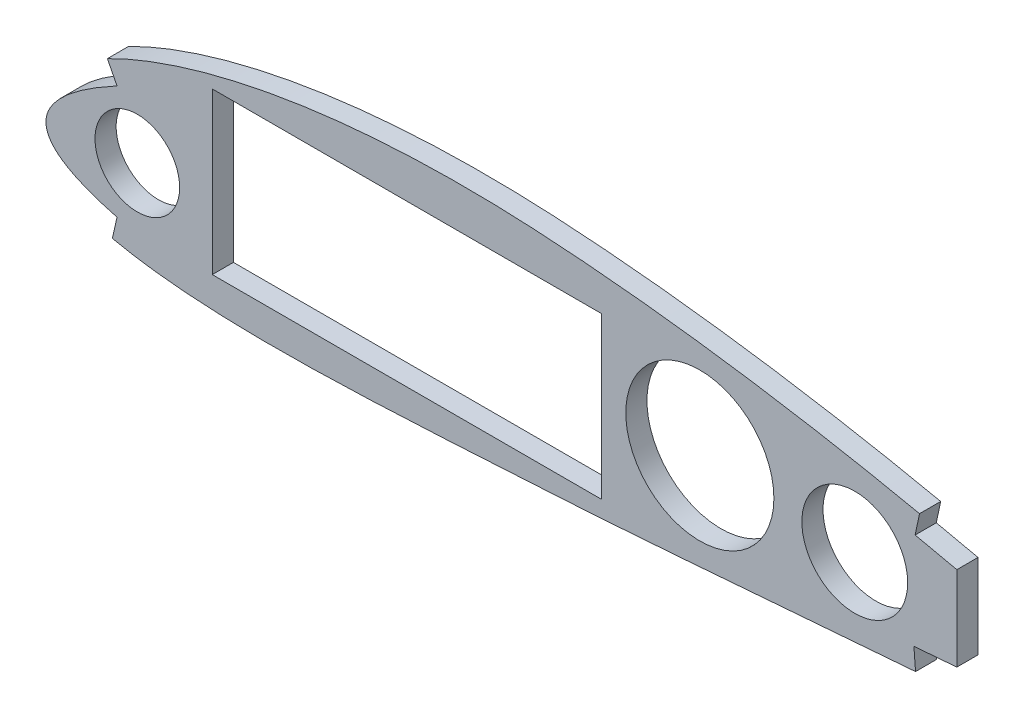
from build123d import *

# Parameters (mm, degrees)
MASTER_SKETCH_WING_GEOMETRY_MASTER_SKETC_R   = 10
MASTER_SKETCH_WING_GEOMETRY_MASTER_SKETC_W   = 92
MASTER_SKETCH_WING_GEOMETRY_MASTER_SKETC_H   = 38
MASTER_SKETCH_WING_GEOMETRY_MASTER_SKETC_R_2 = 12.5
MASTER_SKETCH_WING_GEOMETRY_MASTER_SKETC_R_3 = 17.5
BOSS_EXTRUDE2_DEPTH                          = 5


with BuildPart() as part:
    # Master sketch-Wing Geometry Master Sketc → Boss-Extrude2 (new body)
    with BuildSketch(Plane.XY):
        with BuildLine():
            Line((210.07475011, 20.55043194), (211.114806417, 25.441064095))
            add(Edge.make_bspline(
                [(211.114806417, 25.441064095), (210.423359837, 25.588109171), (208.256226378, 26.046518307), (204.590060504, 26.80992466), (200.100470305, 27.709491549), (195.551555784, 28.574874953), (190.957101153, 29.440580512), (186.312819207, 30.266153712), (181.629850434, 31.069092462), (176.911633472, 31.833504414), (172.163553808, 32.589756341), (167.386378314, 33.297913229), (162.585397476, 33.965141895), (157.772606773, 34.60690524), (152.945783838, 35.207030951), (148.116103717, 35.768371218), (143.281947921, 36.275964114), (138.451826021, 36.746166863), (133.632024585, 37.177420244), (128.825099136, 37.557009572), (124.035268277, 37.890964919), (119.227934324, 38.158056396), (114.414879536, 38.383930966), (109.600810746, 38.523171189), (104.830170116, 38.581209103), (100.103024464, 38.571187104), (95.428917776, 38.495242632), (90.811807971, 38.332326352), (86.257821528, 38.103740215), (81.770642032, 37.802892678), (77.355663903, 37.439401702), (73.023107372, 36.981755849), (68.77458737, 36.478522782), (64.618104025, 35.895217538), (60.552867783, 35.25916861), (56.589427231, 34.548268384), (52.728147609, 33.780528228), (48.978480985, 32.948622201), (45.340648206, 32.070500948), (41.817597831, 31.144685204), (38.422513869, 30.152277869), (35.148426276, 29.122139824), (32.002488884, 28.056760571), (28.991053216, 26.94735735), (26.116143259, 25.797761949), (23.382030001, 24.605992477), (21.092241599, 23.54817715), (19.726805869, 22.866225277), (19.219088354, 22.606550883)],
                knots=[0.147831525, 0.147831525, 0.147831525, 0.147831525, 0.151223285, 0.15845953, 0.165799086, 0.173192204, 0.180676633, 0.188231103, 0.195824579, 0.203473251, 0.211164227, 0.218892942, 0.226644195, 0.234420668, 0.24218898, 0.249981423, 0.257749175, 0.26551047, 0.273265831, 0.280966678, 0.288645672, 0.296302699, 0.304067471, 0.31176355, 0.319408994, 0.326957892, 0.334443893, 0.34183727, 0.349123554, 0.356320599, 0.363414403, 0.370376839, 0.377222796, 0.383940401, 0.390513899, 0.396964017, 0.403259098, 0.409401768, 0.415391075, 0.421213922, 0.426877502, 0.432360647, 0.437681281, 0.442812195, 0.447757077, 0.452534713, 0.457121248, 0.459857253, 0.459857253, 0.459857253, 0.459857253], degree=3))
            Line((19.219088354, 22.606550883), (21.49585547, 18.154997053))
            add(Edge.make_bspline(
                [(21.49585547, 18.154997053), (-12.082056869, 0.079644189), (21.495939944, -8.707202746)],
                knots=[0, 0, 0, 1, 1, 1], degree=2))
            Line((21.495939944, -8.707202746), (20.394317181, -13.584335848))
            add(Edge.make_bspline(
                [(20.394317181, -13.584335848), (20.878636368, -13.693731476), (22.176487001, -13.975597653), (24.333802223, -14.388616706), (26.902677481, -14.802759919), (29.579032983, -15.186644107), (32.364727066, -15.507317142), (35.24979682, -15.818395551), (38.24224316, -16.045446189), (41.331828524, -16.260981777), (44.519015875, -16.42830612), (47.799283263, -16.558119697), (51.16623897, -16.647932894), (54.61986093, -16.695073811), (58.159965351, -16.714295991), (61.783518843, -16.708264717), (65.483463359, -16.650825987), (69.256985649, -16.584892049), (73.10377458, -16.484484885), (77.020259272, -16.35080262), (81.003979497, -16.205643438), (85.050068364, -16.018089633), (89.157165379, -15.833715938), (93.320145134, -15.619391907), (97.536821023, -15.399674924), (101.807253217, -15.173788761), (106.123150678, -14.916806976), (110.483633277, -14.67183184), (114.883266318, -14.40885373), (119.352975093, -14.1438502), (123.894349232, -13.897019305), (128.496857287, -13.599501008), (133.130234778, -13.300324022), (137.784055517, -12.993867357), (142.453682427, -12.661474057), (147.129863453, -12.318169381), (151.814228379, -11.985316734), (156.499893797, -11.618572445), (161.183377828, -11.260601924), (165.86046019, -10.90254886), (170.523341726, -10.530097392), (175.17012114, -10.161520293), (179.793367843, -9.790428778), (184.3901672, -9.422077018), (188.959593481, -9.048259618), (193.49686261, -8.692457096), (197.993446272, -8.331402015), (202.443627904, -7.973643055), (206.497194094, -7.635119669), (209.069001496, -7.436255041), (210.173597999, -7.350571372)],
                knots=[0.551686861, 0.551686861, 0.551686861, 0.551686861, 0.554069096, 0.558058927, 0.562223755, 0.566552856, 0.571030235, 0.575677162, 0.580474566, 0.585427924, 0.590537056, 0.595787007, 0.601178702, 0.606697002, 0.612358753, 0.618164376, 0.624082472, 0.63011302, 0.636272552, 0.642545409, 0.648915298, 0.655399016, 0.66197932, 0.668641043, 0.67539942, 0.682238498, 0.689159203, 0.696143776, 0.703193144, 0.710306375, 0.717627174, 0.725014702, 0.73243517, 0.739904564, 0.747392102, 0.754896736, 0.762401371, 0.769924336, 0.777447302, 0.784938376, 0.792430695, 0.799891129, 0.807303734, 0.814684455, 0.822017351, 0.829301143, 0.836521163, 0.843661474, 0.850722081, 0.856037867, 0.856037867, 0.856037867, 0.856037867], degree=3))
            Line((210.173597999, -7.350571372), (209.78690169, -2.365451127))
            Line((209.78690169, -2.365451127), (219.93, -1.558186688))
            Line((219.93, -1.558186688), (219.93, 18.391622486))
            Line((219.93, 18.391622486), (210.07475011, 20.55043194))
        make_face()
        with Locations((26.291015868, 4.759044754)):
            Circle(MASTER_SKETCH_WING_GEOMETRY_MASTER_SKETC_R, mode=Mode.SUBTRACT)
        with Locations((90.000000001, 9.799999997)):
            Rectangle(MASTER_SKETCH_WING_GEOMETRY_MASTER_SKETC_W, MASTER_SKETCH_WING_GEOMETRY_MASTER_SKETC_H, mode=Mode.SUBTRACT)
        with Locations((195.809022747, 9.888215346)):
            Circle(MASTER_SKETCH_WING_GEOMETRY_MASTER_SKETC_R_2, mode=Mode.SUBTRACT)
        with Locations((159.205482831, 11.38801065)):
            Circle(MASTER_SKETCH_WING_GEOMETRY_MASTER_SKETC_R_3, mode=Mode.SUBTRACT)
    extrude(amount=BOSS_EXTRUDE2_DEPTH)


solid = part.part
